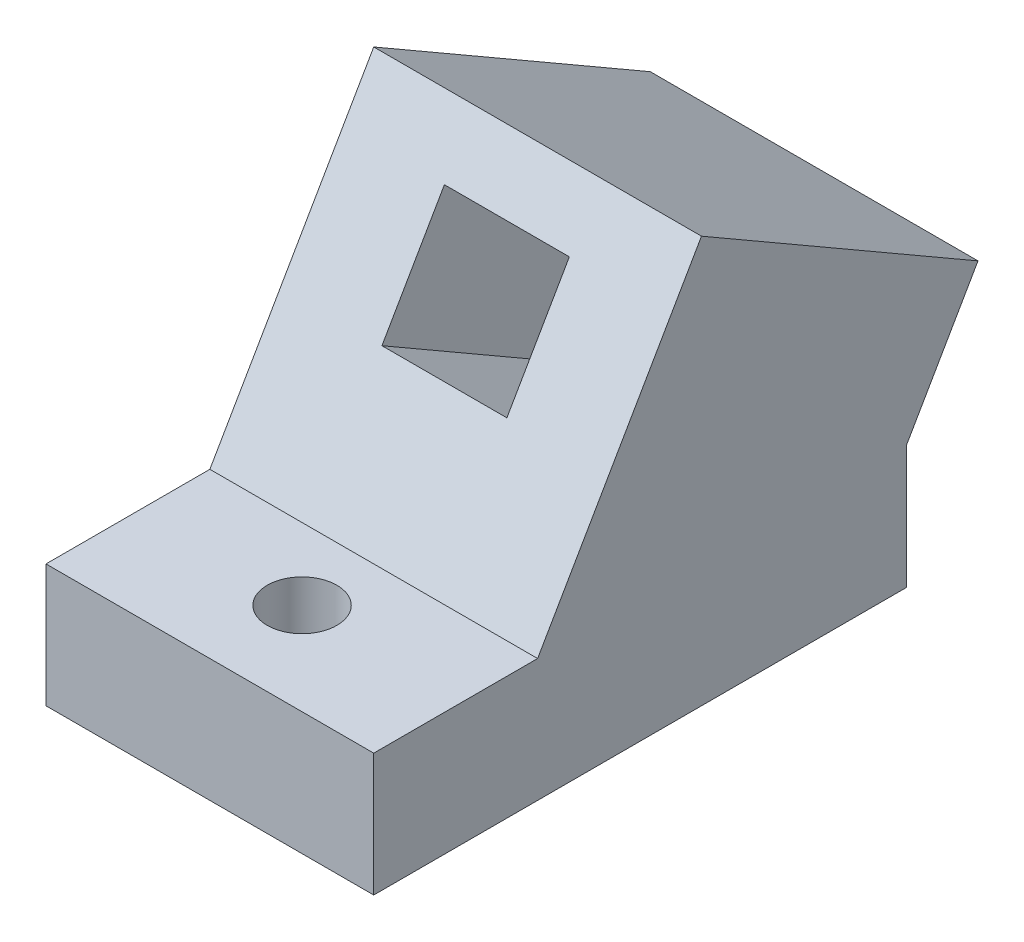
from build123d import *

# Parameters (mm, degrees)
SKETCH_6_W          = 8
SKETCH_6_H          = 13
SKETCH_6_R          = 0.85
EXTRUDE_1_DEPTH     = 3
EXTRUDE_2_DEPTH     = 8
SKETCH_9_W          = 3.05
SKETCH_9_H          = 3.05
CUT_EXTRUDE_3_DEPTH = 19.796569864


with BuildPart() as part:
    # 草图6 → 凸台-拉伸1 (new body)
    with BuildSketch(Plane(origin=(0, 0, 0), x_dir=(1, 0, 0), z_dir=(0, 1, 0))):
        with Locations((4, 6.5)):
            Rectangle(SKETCH_6_W, SKETCH_6_H)
        with Locations(Location((4, 2.25, 0), (0, 0, 270))):
            Circle(SKETCH_6_R, mode=Mode.SUBTRACT)
        with Locations(Location((4, 10.75, 0), (0, 0, 90))):
            Circle(SKETCH_6_R, mode=Mode.SUBTRACT)
    extrude(amount=EXTRUDE_1_DEPTH)

    # 草图8 → 凸台-拉伸2 (add)
    with BuildSketch(Plane(origin=(8, 0, 0), x_dir=(0, 0, -1), z_dir=(1, 0, 0))):
        Polygon((13, 3), (14.75, 6.031088913), (8, 9.92820323), (4, 3), align=None)
    extrude(amount=-EXTRUDE_2_DEPTH)

    # 草图9 → 切除-拉伸3 (cut, through all)
    with BuildSketch(Plane(origin=(0, -0.982050808, -1.700961894), x_dir=(1, 0, 0), z_dir=(0, 0.500000000000004, 0.8660254037844364))):
        with Locations((4, 9.573076211)):
            Rectangle(SKETCH_9_W, SKETCH_9_H)
    extrude(amount=-CUT_EXTRUDE_3_DEPTH, mode=Mode.SUBTRACT)


solid = part.part
